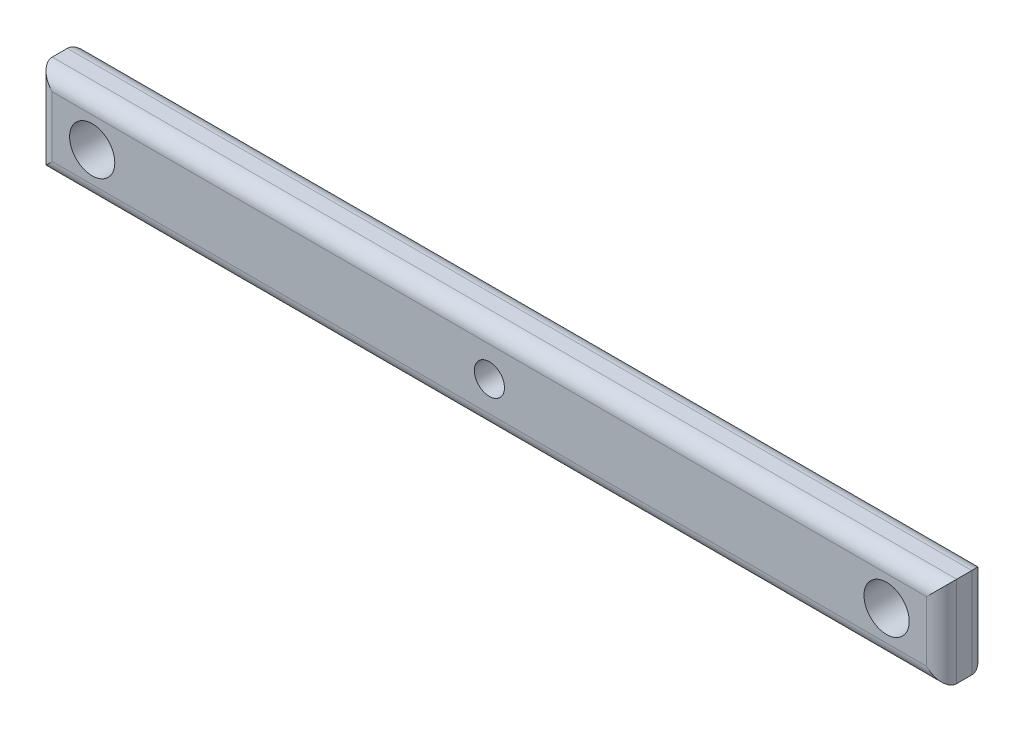
from build123d import *

# Parameters (mm, degrees)
CROQUIS1_W              = 60
CROQUIS1_H              = 6
SALIENTE_EXTRUIR1_DEPTH = 3
REDONDEO1_R             = 1
CROQUIS2_R              = 1.5
CROQUIS2_R_2            = 1
CORTAR_EXTRUIR1_DEPTH   = 31.298514815


with BuildPart() as part:
    # Croquis1 → Saliente-Extruir1 (new body)
    with BuildSketch(Plane.XY):
        Rectangle(CROQUIS1_W, CROQUIS1_H)
    extrude(amount=SALIENTE_EXTRUIR1_DEPTH)

    # Redondeo1
    redondeo1_edges = [part.edges().sort_by_distance(p)[0] for p in [
        (30, 0, 3),
        (0, 3, 3),
        (-30, 0, 3),
        (0, 3, 0),
        (30, 0, 0),
        (0, -3, 0),
        (-30, 0, 0),
        (0, -3, 3),
    ]]
    fillet(redondeo1_edges, radius=REDONDEO1_R)

    # Croquis2 → Cortar-Extruir1 (cut, through all)
    with BuildSketch(Plane.XY.offset(3)):
        with Locations((-26.35, 0)):
            Circle(CROQUIS2_R)
        with Locations((26.35, 0)):
            Circle(CROQUIS2_R)
        Circle(CROQUIS2_R_2)
    extrude(amount=-CORTAR_EXTRUIR1_DEPTH, mode=Mode.SUBTRACT)


solid = part.part
